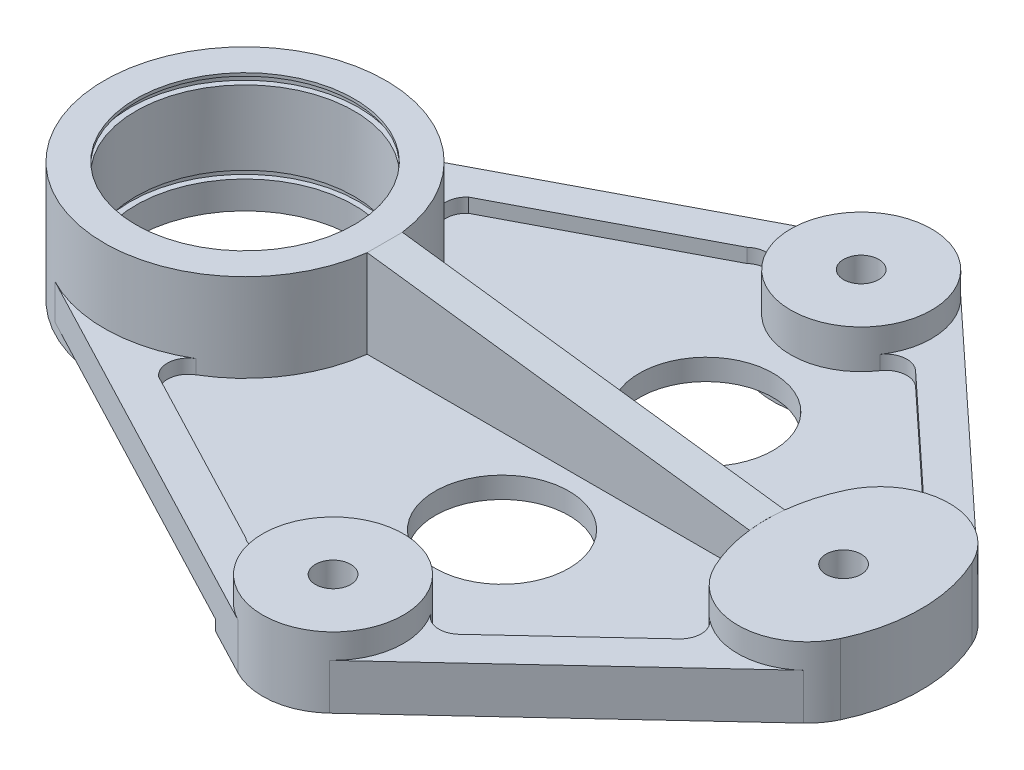
from build123d import *

# Parameters (mm, degrees)
SKETCH1_R                = 9.5
BOSS_EXTRUDE1_DEPTH      = 3
BOSS_EXTRUDE1_2_DEPTH    = 3
BOSS_EXTRUDE2_DEPTH      = 5
BOSS_EXTRUDE3_DEPTH      = 15.5
BOSS_EXTRUDE3_DEPTH_BACK = 1.5
BOSS_EXTRUDE4_DEPTH      = 8.5
BOSS_EXTRUDE4_DEPTH_BACK = 1.5
SKETCH1_5_R              = 10
SKETCH1_5_R_2            = 2.5
BOSS_EXTRUDE5_DEPTH      = 8.5
BOSS_EXTRUDE5_DEPTH_BACK = 1.5
SKETCH1_6_R              = 2.5
BOSS_EXTRUDE6_DEPTH      = 15.5
BOSS_EXTRUDE6_DEPTH_BACK = 1.5
SKETCH1_7_R              = 15.5
CUT_EXTRUDE1_REACH       = 89.409
SKETCH8_W                = 16.25
SKETCH8_H                = 1.075
BOSS_EXTRUDE7_START      = 1.5
BOSS_EXTRUDE7_DEPTH      = 1.5


with BuildPart() as part:
    # Sketch1 → Boss-Extrude1 (new body)
    with BuildSketch(Plane(origin=(0, 0, 0), x_dir=(1, 0, 0), z_dir=(0, 1, 0))):
        with BuildLine():
            ThreePointArc((8.284210438, 31.898941402), (-1.363739049, 27.593425627), (-9.489477618, 34.345667337))
            ThreePointArc((-9.489477618, 34.345667337), (-11.573635866, 36.300800208), (-14.349825716, 35.623282637))
            Line((-14.349825716, 35.623282637), (-40.302516761, 22.019186222))
            ThreePointArc((-40.302516761, 22.019186222), (-41.273789994, 19.493443338), (-39.816532128, 17.213279237))
            ThreePointArc((-39.816532128, 17.213279237), (-33.281167386, 10.97636716), (-30.156865167, 2.5))
            Line((-30.156865167, 2.5), (24.142507006, 2.5))
            ThreePointArc((24.142507006, 2.5), (24.834057729, 6.000240645), (26.082304527, 9.342665949))
            ThreePointArc((26.082304527, 9.342665949), (27.255658523, 11.24637974), (28.828183508, 12.836364321))
            ThreePointArc((28.828183508, 12.836364321), (29.944640188, 15.02344116), (29.053717415, 17.311680053))
            Line((29.053717415, 17.311680053), (12.87474854, 32.355869082))
            ThreePointArc((12.87474854, 32.355869082), (10.472331387, 33.203871974), (8.284210438, 31.898941402))
        make_face()
        with Locations((1, 14.5)):
            Circle(SKETCH1_R, mode=Mode.SUBTRACT)
    extrude(amount=BOSS_EXTRUDE1_DEPTH)



with BuildPart() as body_2:
    # Sketch1 → Boss-Extrude1 2 (new body)
    with BuildSketch(Plane(origin=(0, 0, 0), x_dir=(1, 0, 0), z_dir=(0, 1, 0))):
        with BuildLine():
            ThreePointArc((-30.156865167, -2.5), (-33.272749334, -10.963534337), (-39.790126097, -17.197629921))
            ThreePointArc((-39.790126097, -17.197629921), (-41.249487369, -19.543048034), (-40.173039204, -22.087056839))
            Line((-40.173039204, -22.087056839), (-14.241082593, -35.680284508))
            ThreePointArc((-14.241082593, -35.680284508), (-11.504148883, -36.255537388), (-9.482068, -34.323463137))
            ThreePointArc((-9.482068, -34.323463137), (-1.352594655, -27.591897876), (8.28370035, -31.898187034))
            ThreePointArc((8.28370035, -31.898187034), (10.418414325, -33.197109967), (12.796233312, -32.428877315))
            Line((12.796233312, -32.428877315), (28.974944097, -17.384928273))
            ThreePointArc((28.974944097, -17.384928273), (29.945946241, -15.076495792), (28.827477371, -12.835796554))
            ThreePointArc((28.827477371, -12.835796554), (27.255378579, -11.246023539), (26.082304527, -9.342665949))
            ThreePointArc((26.082304527, -9.342665949), (24.834057729, -6.000240645), (24.142507006, -2.5))
            Line((24.142507006, -2.5), (-30.156865167, -2.5))
        make_face()
        with Locations((1, -14.5)):
            Circle(SKETCH1_R, mode=Mode.SUBTRACT)
    extrude(amount=BOSS_EXTRUDE1_2_DEPTH)


with BuildPart() as part_1:
    add(part.part)

    add(body_2.part)  # Boss-Extrude2 merges body 2
    # Sketch1<3> → Boss-Extrude2 (add)
    with BuildSketch(Plane(origin=(0, 0, 0), x_dir=(1, 0, 0), z_dir=(0, 1, 0))):
        with BuildLine():
            ThreePointArc((-9.489477618, 34.345667337), (-9.273471314, 41.242022153), (-4.642702086, 46.356936115))
            Line((-4.642702086, 46.356936115), (-59.285404172, 17.713872229))
            ThreePointArc((-59.285404172, 17.713872229), (-49.4859203, 19.99339196), (-39.816532128, 17.213279237))
            ThreePointArc((-39.816532128, 17.213279237), (-41.273789994, 19.493443338), (-40.302516761, 22.019186222))
            Line((-40.302516761, 22.019186222), (-14.349825716, 35.623282637))
            ThreePointArc((-14.349825716, 35.623282637), (-11.573635866, 36.300800208), (-9.489477618, 34.345667337))
        make_face()
        with BuildLine():
            Line((41.707436105, 12.373076129), (6.809579802, 44.823224898))
            ThreePointArc((6.809579802, 44.823224898), (9.935537325, 38.633621661), (8.284210438, 31.898941402))
            ThreePointArc((8.284210438, 31.898941402), (10.472331387, 33.203871974), (12.87474854, 32.355869082))
            Line((12.87474854, 32.355869082), (29.053717415, 17.311680053))
            ThreePointArc((29.053717415, 17.311680053), (29.944640188, 15.02344116), (28.828183508, 12.836364321))
            ThreePointArc((28.828183508, 12.836364321), (35.354091909, 15.003333024), (41.707436105, 12.373076129))
        make_face()
        with BuildLine():
            ThreePointArc((-39.790126097, -17.197629921), (-49.47057805, -19.992991582), (-59.285404172, -17.713872229))
            Line((-59.285404172, -17.713872229), (-4.642702086, -46.356936115))
            ThreePointArc((-4.642702086, -46.356936115), (-9.277844603, -41.231165974), (-9.482068, -34.323463137))
            ThreePointArc((-9.482068, -34.323463137), (-11.504148883, -36.255537388), (-14.241082593, -35.680284508))
            Line((-14.241082593, -35.680284508), (-40.173039204, -22.087056839))
            ThreePointArc((-40.173039204, -22.087056839), (-41.249487369, -19.543048034), (-39.790126097, -17.197629921))
        make_face()
        with BuildLine():
            ThreePointArc((8.28370035, -31.898187034), (9.93558893, -38.633169276), (6.809579802, -44.823224898))
            Line((6.809579802, -44.823224898), (41.707436105, -12.373076129))
            ThreePointArc((41.707436105, -12.373076129), (35.353639159, -15.0033493), (28.827477371, -12.835796554))
            ThreePointArc((28.827477371, -12.835796554), (29.945946241, -15.076495792), (28.974944097, -17.384928273))
            Line((28.974944097, -17.384928273), (12.796233312, -32.428877315))
            ThreePointArc((12.796233312, -32.428877315), (10.418414325, -33.197109967), (8.28370035, -31.898187034))
        make_face()
    extrude(amount=BOSS_EXTRUDE2_DEPTH)

    # Sketch1<4> → Boss-Extrude3 (add, two sides: drawn at the far end of the back side and taken through both)
    with BuildSketch(Plane(origin=(0, 0, 0), x_dir=(1, 0, 0), z_dir=(0, 1, 0)).offset(-BOSS_EXTRUDE3_DEPTH_BACK)):
        with BuildLine():
            Line((24.142507006, 2.5), (-30.156865167, 2.5))
            ThreePointArc((-30.156865167, 2.5), (-30.039254815, 1.252458251), (-30, 0))
            ThreePointArc((-30, 0), (-30.039254815, -1.252458251), (-30.156865167, -2.5))
            Line((-30.156865167, -2.5), (24.142507006, -2.5))
            ThreePointArc((24.142507006, -2.5), (24, 0), (24.142507006, 2.5))
        make_face()
    extrude(amount=BOSS_EXTRUDE3_DEPTH + BOSS_EXTRUDE3_DEPTH_BACK)

    # Sketch1<5> → Boss-Extrude4 (add, two sides: drawn at the far end of the back side and taken through both)
    # profile 1 of 2: a face of its own
    with BuildSketch(Plane(origin=(0, 0, 0), x_dir=(1, 0, 0), z_dir=(0, 1, 0)).offset(-BOSS_EXTRUDE4_DEPTH_BACK)):
        with Locations((0, 37.5)):
            Circle(SKETCH1_5_R)
        with Locations((0, 37.5)):
            Circle(SKETCH1_5_R_2, mode=Mode.SUBTRACT)
    # profile 2 of 2: a face of its own
    with BuildSketch(Plane(origin=(0, 0, 0), x_dir=(1, 0, 0), z_dir=(0, 1, 0)).offset(-BOSS_EXTRUDE4_DEPTH_BACK)):
        with Locations((0, -37.5)):
            Circle(SKETCH1_5_R)
        with Locations((0, -37.5)):
            Circle(SKETCH1_5_R_2, mode=Mode.SUBTRACT)
    extrude(amount=BOSS_EXTRUDE4_DEPTH + BOSS_EXTRUDE4_DEPTH_BACK)

    # Sketch1<6> → Boss-Extrude5 (add, two sides: drawn at the far end of the back side and taken through both)
    with BuildSketch(Plane(origin=(0, 0, 0), x_dir=(1, 0, 0), z_dir=(0, 1, 0)).offset(-BOSS_EXTRUDE5_DEPTH_BACK)):
        with BuildLine():
            ThreePointArc((43.917695473, 9.342665949), (42.958142414, 10.964048777), (41.707436105, 12.373076129))
            ThreePointArc((41.707436105, 12.373076129), (35.354091909, 15.003333024), (28.828183508, 12.836364321))
            ThreePointArc((28.828183508, 12.836364321), (27.255658523, 11.24637974), (26.082304527, 9.342665949))
            ThreePointArc((26.082304527, 9.342665949), (24.834057729, 6.000240645), (24.142507006, 2.5))
            ThreePointArc((24.142507006, 2.5), (24, 0), (24.142507006, -2.5))
            ThreePointArc((24.142507006, -2.5), (24.834057729, -6.000240645), (26.082304527, -9.342665949))
            ThreePointArc((26.082304527, -9.342665949), (27.255378579, -11.246023539), (28.827477371, -12.835796554))
            ThreePointArc((28.827477371, -12.835796554), (35.353639159, -15.0033493), (41.707436105, -12.373076129))
            ThreePointArc((41.707436105, -12.373076129), (42.958142414, -10.964048777), (43.917695473, -9.342665949))
            ThreePointArc((43.917695473, -9.342665949), (46, 0), (43.917695473, 9.342665949))
        make_face()
        with Locations((35, 0)):
            Circle(SKETCH1_6_R, mode=Mode.SUBTRACT)
    extrude(amount=BOSS_EXTRUDE5_DEPTH + BOSS_EXTRUDE5_DEPTH_BACK)

    # Sketch1<7> → Boss-Extrude6 (add, two sides: drawn at the far end of the back side and taken through both)
    with BuildSketch(Plane(origin=(0, 0, 0), x_dir=(1, 0, 0), z_dir=(0, 1, 0)).offset(-BOSS_EXTRUDE6_DEPTH_BACK)):
        with BuildLine():
            ThreePointArc((-39.816532128, 17.213279237), (-49.4859203, 19.99339196), (-59.285404172, 17.713872229))
            ThreePointArc((-59.285404172, 17.713872229), (-70, 0), (-59.285404172, -17.713872229))
            ThreePointArc((-59.285404172, -17.713872229), (-49.47057805, -19.992991582), (-39.790126097, -17.197629921))
            ThreePointArc((-39.790126097, -17.197629921), (-33.272749334, -10.963534337), (-30.156865167, -2.5))
            ThreePointArc((-30.156865167, -2.5), (-30.039254815, -1.252458251), (-30, 0))
            ThreePointArc((-30, 0), (-30.039254815, 1.252458251), (-30.156865167, 2.5))
            ThreePointArc((-30.156865167, 2.5), (-33.281167386, 10.97636716), (-39.816532128, 17.213279237))
        make_face()
        with Locations((-50, 0)):
            Circle(SKETCH1_7_R, mode=Mode.SUBTRACT)
    extrude(amount=BOSS_EXTRUDE6_DEPTH + BOSS_EXTRUDE6_DEPTH_BACK)

    # Sketch3 → Cut-Extrude1 (cut, up to next)
    with BuildSketch(Plane.XY.offset(2.5), mode=Mode.PRIVATE) as cut_extrude1_sk1:
        Polygon((-30.156865167, 15.5), (24.142507006, 8.5), (24.142507006, 15.5), align=None)
    cut_extrude1_tool1 = extrude(cut_extrude1_sk1.sketch, amount=-CUT_EXTRUDE1_REACH, mode=Mode.PRIVATE) & part_1.part
    add(cut_extrude1_tool1.solids().sort_by_distance((6.042716, 13.166667, 2.5))[0], mode=Mode.SUBTRACT)

    # Sketch8 → Cut-Revolve2 (revolve, cut)
    with BuildSketch(Plane.XY):
        with Locations((-41.953432584, 14.5375)):
            Rectangle(SKETCH8_W, SKETCH8_H)
        with Locations((-41.953432584, 2.9625)):
            Rectangle(SKETCH8_W, SKETCH8_H)
    revolve(axis=Axis((-50.078432584, 15.075, 0), (0, -1, 0)), mode=Mode.SUBTRACT)

    # Sketch11 → Boss-Extrude7 (add)
    with BuildSketch(Plane.XZ.offset(BOSS_EXTRUDE7_START)):
        with BuildLine():
            Line((6.809579802, -44.823224898), (41.707436105, -12.373076129))
            ThreePointArc((41.707436105, -12.373076129), (33.124591223, -14.829515627), (26.082304527, -9.342665949))
            ThreePointArc((26.082304527, -9.342665949), (24.834057729, -6.000240645), (24.142507006, -2.5))
            Line((24.142507006, -2.5), (21.5, -2.5))
            Line((21.5, -2.5), (21.5, -11.421704032))
            ThreePointArc((21.5, -11.421704032), (21.250329237, -12.619906472), (20.542873941, -13.618671501))
            Line((20.542873941, -13.618671501), (7.921337912, -25.354943159))
            ThreePointArc((7.921337912, -25.354943159), (6.415668049, -26.109485774), (4.740696751, -25.933851362))
            ThreePointArc((4.740696751, -25.933851362), (-9.080647661, -28.909782421), (-11.285404172, -42.87490955))
            Line((-11.285404172, -42.87490955), (-4.642702086, -46.356936115))
            ThreePointArc((-4.642702086, -46.356936115), (-1.327368556, -27.58848686), (6.809579802, -44.823224898))
        make_face()
        with BuildLine():
            Line((41.707436105, 12.373076129), (6.809579802, 44.823224898))
            ThreePointArc((6.809579802, 44.823224898), (-1.327368556, 27.58848686), (-4.642702086, 46.356936115))
            Line((-4.642702086, 46.356936115), (-11.285404172, 42.87490955))
            ThreePointArc((-11.285404172, 42.87490955), (-9.080647661, 28.909782421), (4.740696751, 25.933851362))
            ThreePointArc((4.740696751, 25.933851362), (6.415668049, 26.109485774), (7.921337912, 25.354943159))
            Line((7.921337912, 25.354943159), (20.542873941, 13.618671501))
            ThreePointArc((20.542873941, 13.618671501), (21.250329237, 12.619906472), (21.5, 11.421704032))
            Line((21.5, 11.421704032), (21.5, 2.5))
            Line((21.5, 2.5), (24.142507006, 2.5))
            ThreePointArc((24.142507006, 2.5), (24.834057729, 6.000240645), (26.082304527, 9.342665949))
            ThreePointArc((26.082304527, 9.342665949), (33.124591223, 14.829515627), (41.707436105, 12.373076129))
        make_face()
    extrude(amount=-BOSS_EXTRUDE7_DEPTH)


solid = part_1.part
